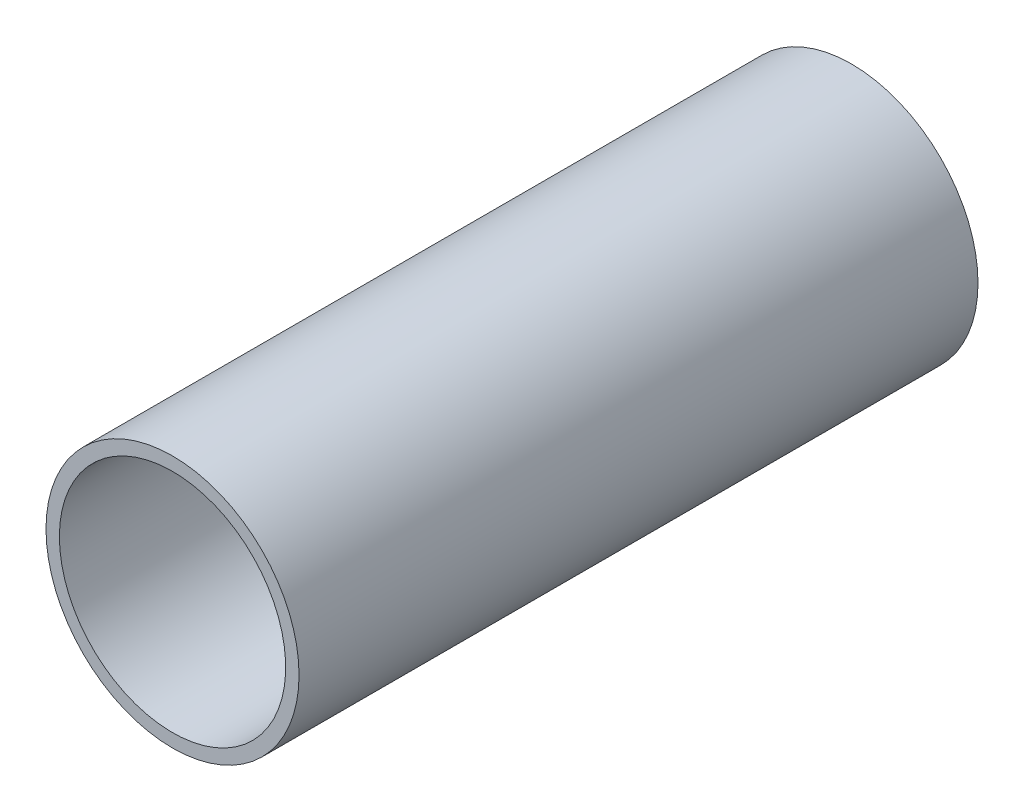
from build123d import *

# Parameters (mm, degrees)
SKETCH1_R           = 28.4
SKETCH1_R_2         = 25.4
BOSS_EXTRUDE1_DEPTH = 152.4


with BuildPart() as part:
    # Sketch1 → Boss-Extrude1 (new body)
    with BuildSketch(Plane.XY):
        with Locations(Location((0, 0, 0), (0, 0, 180))):
            Circle(SKETCH1_R)
        with Locations(Location((0, 0, 0), (0, 0, 180))):
            Circle(SKETCH1_R_2, mode=Mode.SUBTRACT)
    extrude(amount=BOSS_EXTRUDE1_DEPTH)


solid = part.part
